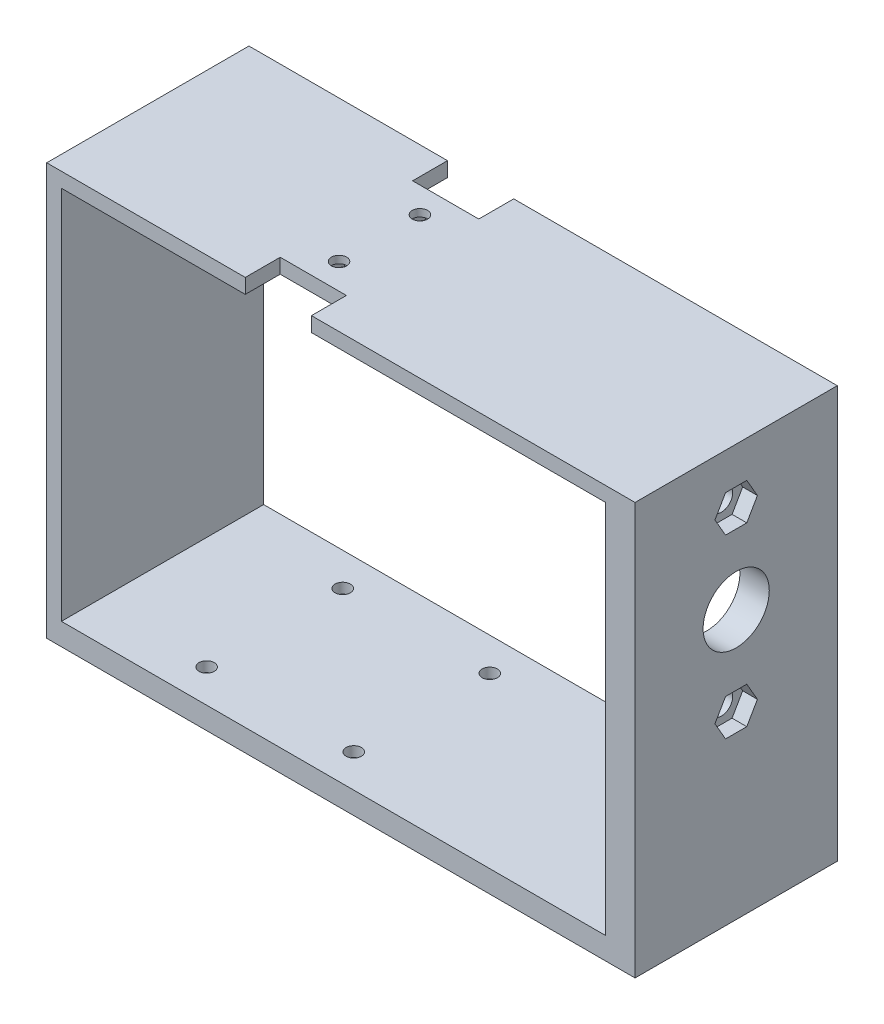
from build123d import *

# Parameters (mm, degrees)
SKETCH1_W           = 55
SKETCH1_H           = 112
BOSS_EXTRUDE1_DEPTH = 160
CUT_EXTRUDE1_REACH  = 204.901
SKETCH2_W           = 148
SKETCH2_H           = 102
CUT_EXTRUDE2_REACH  = 198.655
SKETCH3_R           = 9
SKETCH3_R_2         = 3.05
CUT_EXTRUDE4_DEPTH  = 4
CUT_EXTRUDE11_REACH = 204.901
SKETCH15_R          = 2.075
CUT_EXTRUDE12_DEPTH = 3.2
CUT_EXTRUDE14_REACH = 204.901
SKETCH17_W          = 18
SKETCH17_H          = 9.5
CUT_EXTRUDE15_REACH = 204.901
SKETCH19_R          = 2.075
CUT_EXTRUDE16_DEPTH = 2


with BuildPart() as part:
    # Sketch1 → Boss-Extrude1 (new body)
    with BuildSketch(Plane(origin=(0, 0, 0), x_dir=(0, 0, -1), z_dir=(1, 0, 0))):
        with Locations((27.5, -56)):
            Rectangle(SKETCH1_W, SKETCH1_H)
    extrude(amount=BOSS_EXTRUDE1_DEPTH)

    # Sketch2 → Cut-Extrude1 (cut, up to next)
    with BuildSketch(Plane.XY, mode=Mode.PRIVATE) as cut_extrude1_sk1:
        with Locations((78, -55)):
            Rectangle(SKETCH2_W, SKETCH2_H)
    cut_extrude1_tool1 = extrude(cut_extrude1_sk1.sketch, amount=-CUT_EXTRUDE1_REACH, mode=Mode.PRIVATE) & part.part
    add(cut_extrude1_tool1.solids().sort_by_distance((78, -55, 0))[0], mode=Mode.SUBTRACT)

    # Sketch3 → Cut-Extrude2 (cut, up to next)
    with BuildSketch(Plane.ZY.offset(-152), mode=Mode.PRIVATE) as cut_extrude2_sk1:
        with Locations((-27.5, -39)):
            Circle(SKETCH3_R)
    cut_extrude2_tool1 = extrude(cut_extrude2_sk1.sketch, amount=-CUT_EXTRUDE2_REACH, mode=Mode.PRIVATE) & part.part
    # Sketch3 → Cut-Extrude2 (cut, up to next)
    with BuildSketch(Plane.ZY.offset(-152), mode=Mode.PRIVATE) as cut_extrude2_sk2:
        with Locations((-27.5, -15)):
            Circle(SKETCH3_R_2)
    cut_extrude2_tool2 = extrude(cut_extrude2_sk2.sketch, amount=-CUT_EXTRUDE2_REACH, mode=Mode.PRIVATE) & part.part
    # Sketch3 → Cut-Extrude2 (cut, up to next)
    with BuildSketch(Plane.ZY.offset(-152), mode=Mode.PRIVATE) as cut_extrude2_sk3:
        with Locations(Location((-27.5, -63, 0), (0, 0, 180))):
            Circle(SKETCH3_R_2)
    cut_extrude2_tool3 = extrude(cut_extrude2_sk3.sketch, amount=-CUT_EXTRUDE2_REACH, mode=Mode.PRIVATE) & part.part
    add(cut_extrude2_tool1.solids().sort_by_distance((152, -39, -27.5))[0], mode=Mode.SUBTRACT)
    add(cut_extrude2_tool2.solids().sort_by_distance((152, -15, -27.5))[0], mode=Mode.SUBTRACT)
    add(cut_extrude2_tool3.solids().sort_by_distance((152, -63, -27.5))[0], mode=Mode.SUBTRACT)

    # Sketch6 → Cut-Extrude4 (cut)
    with BuildSketch(Plane(origin=(160, 0, 0), x_dir=(0, 0, -1), z_dir=(1, 0, 0))):
        Polygon((30.386751346, -20), (33.273502692, -15), (30.386751346, -10), (24.613248654, -10), (21.726497308, -15), (24.613248654, -20), align=None)
        Polygon((30.386751346, -68), (33.273502692, -63), (30.386751346, -58), (24.613248654, -58), (21.726497308, -63), (24.613248654, -68), align=None)
    extrude(amount=-CUT_EXTRUDE4_DEPTH, mode=Mode.SUBTRACT)

    # Sketch15 → Cut-Extrude11 (cut, up to next)
    with BuildSketch(Plane(origin=(0, -112, 0), x_dir=(-1, 0, 0), z_dir=(0, -1, 0)), mode=Mode.PRIVATE) as cut_extrude11_sk1:
        with Locations(Location((-34.5, 9, 0), (0, 0, 90))):
            Circle(SKETCH15_R)
    cut_extrude11_tool1 = extrude(cut_extrude11_sk1.sketch, amount=-CUT_EXTRUDE11_REACH, mode=Mode.PRIVATE) & part.part
    # Sketch15 → Cut-Extrude11 (cut, up to next)
    with BuildSketch(Plane(origin=(0, -112, 0), x_dir=(-1, 0, 0), z_dir=(0, -1, 0)), mode=Mode.PRIVATE) as cut_extrude11_sk2:
        with Locations(Location((-74.5, 9, 0), (0, 0, 90))):
            Circle(SKETCH15_R)
    cut_extrude11_tool2 = extrude(cut_extrude11_sk2.sketch, amount=-CUT_EXTRUDE11_REACH, mode=Mode.PRIVATE) & part.part
    # Sketch15 → Cut-Extrude11 (cut, up to next)
    with BuildSketch(Plane(origin=(0, -112, 0), x_dir=(-1, 0, 0), z_dir=(0, -1, 0)), mode=Mode.PRIVATE) as cut_extrude11_sk3:
        with Locations(Location((-74.5, 46, 0), (0, 0, 90))):
            Circle(SKETCH15_R)
    cut_extrude11_tool3 = extrude(cut_extrude11_sk3.sketch, amount=-CUT_EXTRUDE11_REACH, mode=Mode.PRIVATE) & part.part
    # Sketch15 → Cut-Extrude11 (cut, up to next)
    with BuildSketch(Plane(origin=(0, -112, 0), x_dir=(-1, 0, 0), z_dir=(0, -1, 0)), mode=Mode.PRIVATE) as cut_extrude11_sk4:
        with Locations(Location((-34.5, 46, 0), (0, 0, 90))):
            Circle(SKETCH15_R)
    cut_extrude11_tool4 = extrude(cut_extrude11_sk4.sketch, amount=-CUT_EXTRUDE11_REACH, mode=Mode.PRIVATE) & part.part
    add(cut_extrude11_tool1.solids().sort_by_distance((34.5, -112, -9))[0], mode=Mode.SUBTRACT)
    add(cut_extrude11_tool2.solids().sort_by_distance((74.5, -112, -9))[0], mode=Mode.SUBTRACT)
    add(cut_extrude11_tool3.solids().sort_by_distance((74.5, -112, -46))[0], mode=Mode.SUBTRACT)
    add(cut_extrude11_tool4.solids().sort_by_distance((34.5, -112, -46))[0], mode=Mode.SUBTRACT)

    # Sketch16 → Cut-Extrude12 (cut)
    with BuildSketch(Plane(origin=(0, -112, 0), x_dir=(-1, 0, 0), z_dir=(0, -1, 0))):
        Polygon((-38.541451884, 9), (-36.520725942, 5.5), (-32.479274058, 5.5), (-30.458548116, 9), (-32.479274058, 12.5), (-36.520725942, 12.5), align=None)
        Polygon((-76.520725942, 12.5), (-78.541451884, 9), (-76.520725942, 5.5), (-72.479274058, 5.5), (-70.458548116, 9), (-72.479274058, 12.5), align=None)
        Polygon((-72.479274058, 42.5), (-76.520725942, 42.5), (-78.541451884, 46), (-76.520725942, 49.5), (-72.479274058, 49.5), (-70.458548116, 46), align=None)
        Polygon((-36.520725942, 42.5), (-38.541451884, 46), (-36.520725942, 49.5), (-32.479274058, 49.5), (-30.458548116, 46), (-32.479274058, 42.5), align=None)
    extrude(amount=-CUT_EXTRUDE12_DEPTH, mode=Mode.SUBTRACT)

    # Sketch17 → Cut-Extrude14 (cut, up to next)
    with BuildSketch(Plane(origin=(0, 0, 0), x_dir=(1, 0, 0), z_dir=(0, 1, 0)), mode=Mode.PRIVATE) as cut_extrude14_sk1:
        with Locations((63, 50.25)):
            Rectangle(SKETCH17_W, SKETCH17_H)
    cut_extrude14_tool1 = extrude(cut_extrude14_sk1.sketch, amount=-CUT_EXTRUDE14_REACH, mode=Mode.PRIVATE) & part.part
    # Sketch17 → Cut-Extrude14 (cut, up to next)
    with BuildSketch(Plane(origin=(0, 0, 0), x_dir=(1, 0, 0), z_dir=(0, 1, 0)), mode=Mode.PRIVATE) as cut_extrude14_sk2:
        with Locations((63, 4.75)):
            Rectangle(SKETCH17_W, SKETCH17_H)
    cut_extrude14_tool2 = extrude(cut_extrude14_sk2.sketch, amount=-CUT_EXTRUDE14_REACH, mode=Mode.PRIVATE) & part.part
    add(cut_extrude14_tool1.solids().sort_by_distance((63, 0, -50.25))[0], mode=Mode.SUBTRACT)
    add(cut_extrude14_tool2.solids().sort_by_distance((63, 0, -4.75))[0], mode=Mode.SUBTRACT)

    # Sketch19 → Cut-Extrude15 (cut, up to next)
    with BuildSketch(Plane(origin=(0, 0, 0), x_dir=(1, 0, 0), z_dir=(0, 1, 0)), mode=Mode.PRIVATE) as cut_extrude15_sk1:
        with Locations(Location((63, 38.5, 0), (0, 0, 270))):
            Circle(SKETCH19_R)
    cut_extrude15_tool1 = extrude(cut_extrude15_sk1.sketch, amount=-CUT_EXTRUDE15_REACH, mode=Mode.PRIVATE) & part.part
    # Sketch19 → Cut-Extrude15 (cut, up to next)
    with BuildSketch(Plane(origin=(0, 0, 0), x_dir=(1, 0, 0), z_dir=(0, 1, 0)), mode=Mode.PRIVATE) as cut_extrude15_sk2:
        with Locations(Location((63, 16.5, 0), (0, 0, 270))):
            Circle(SKETCH19_R)
    cut_extrude15_tool2 = extrude(cut_extrude15_sk2.sketch, amount=-CUT_EXTRUDE15_REACH, mode=Mode.PRIVATE) & part.part
    add(cut_extrude15_tool1.solids().sort_by_distance((63, 0, -38.5))[0], mode=Mode.SUBTRACT)
    add(cut_extrude15_tool2.solids().sort_by_distance((63, 0, -16.5))[0], mode=Mode.SUBTRACT)

    # Sketch20 → Cut-Extrude16 (cut)
    with BuildSketch(Plane.XZ.offset(4)):
        Polygon((67.041451884, -16.5), (65.020725942, -13), (60.979274058, -13), (58.958548116, -16.5), (60.979274058, -20), (65.020725942, -20), align=None)
        Polygon((65.020725942, -35), (67.041451884, -38.5), (65.020725942, -42), (60.979274058, -42), (58.958548116, -38.5), (60.979274058, -35), align=None)
    extrude(amount=-CUT_EXTRUDE16_DEPTH, mode=Mode.SUBTRACT)


solid = part.part
